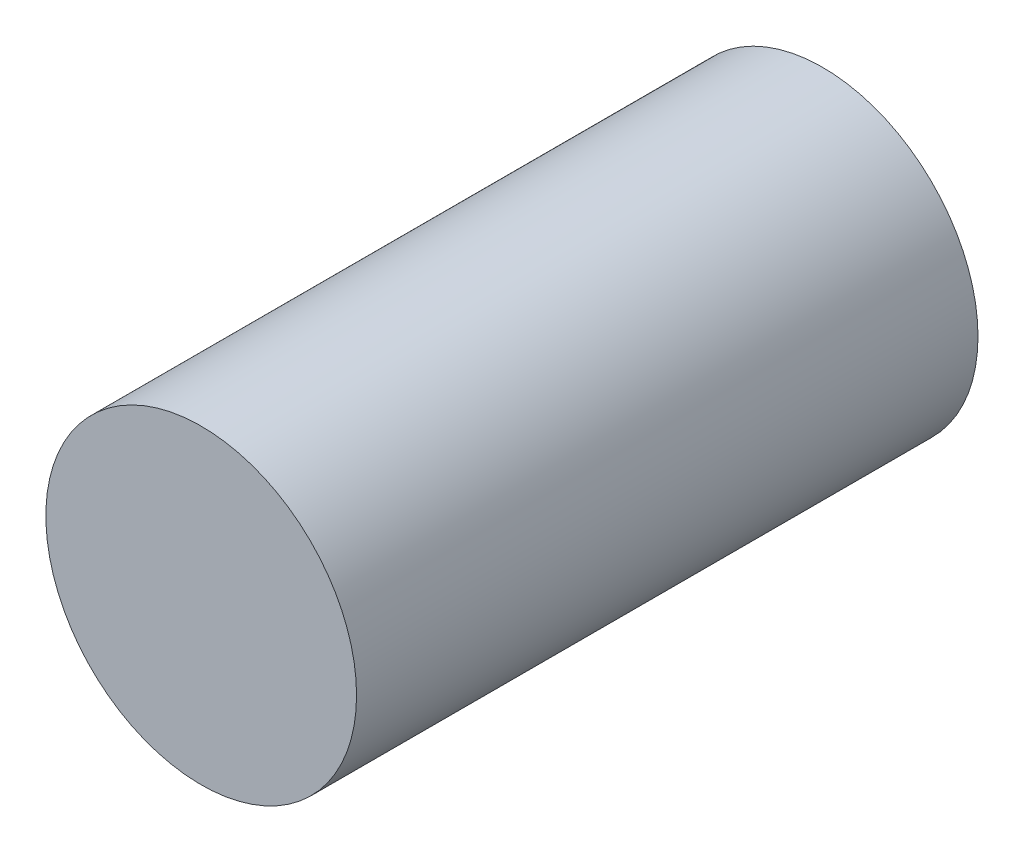
from build123d import *

# Parameters (mm, degrees)
SKETCH_1_R      = 25
EXTRUDE_1_DEPTH = 100


with BuildPart() as part:
    # 草图1 → 凸台-拉伸1 (new body)
    with BuildSketch(Plane.XY):
        Circle(SKETCH_1_R)
    extrude(amount=EXTRUDE_1_DEPTH)


solid = part.part
